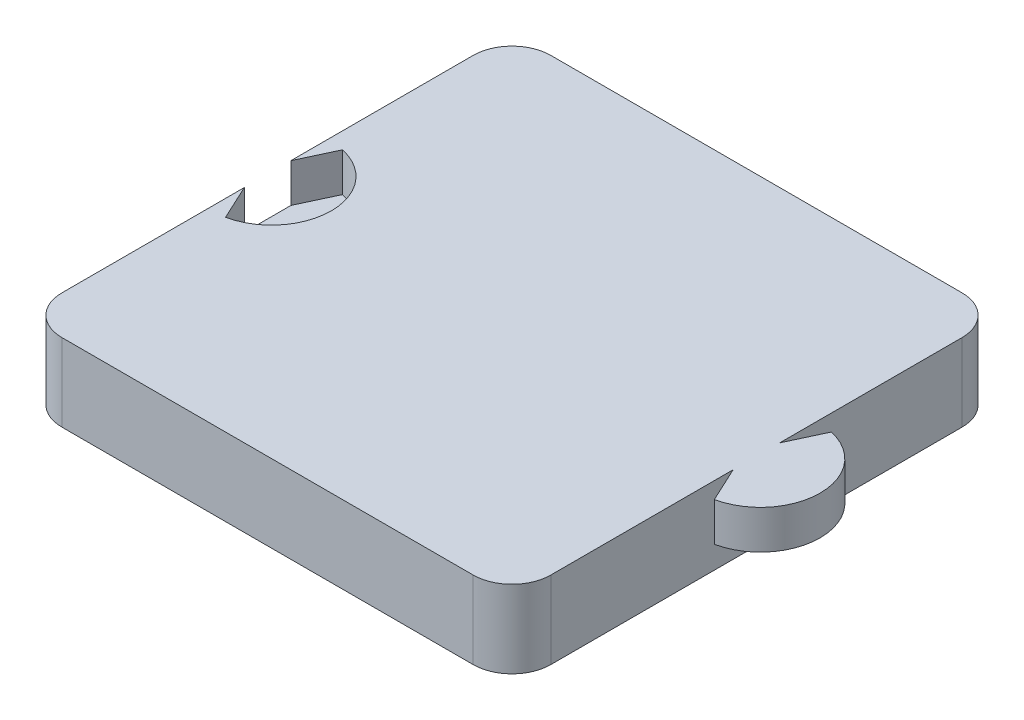
from build123d import *

# Parameters (mm, degrees)
BOSS_EXTRUDE1_DEPTH = 12.7
CUT_EXTRUDE1_DEPTH  = 6.35
BOSS_EXTRUDE2_DEPTH = 6.35


with BuildPart() as part:
    # Sketch1 → Boss-Extrude1 (new body)
    with BuildSketch(Plane(origin=(0, 0, 0), x_dir=(1, 0, 0), z_dir=(0, 1, 0))):
        with BuildLine():
            Line((-33.655, -40.005), (33.655, -40.005))
            ThreePointArc((33.655, -40.005), (38.145128061, -38.145128061), (40.005, -33.655))
            Line((40.005, -33.655), (40.005, 33.655))
            ThreePointArc((40.005, 33.655), (38.145128061, 38.145128061), (33.655, 40.005))
            Line((33.655, 40.005), (-33.655, 40.005))
            ThreePointArc((-33.655, 40.005), (-38.145128061, 38.145128061), (-40.005, 33.655))
            Line((-40.005, 33.655), (-40.005, -33.655))
            ThreePointArc((-40.005, -33.655), (-38.145128061, -38.145128061), (-33.655, -40.005))
        make_face()
    extrude(amount=BOSS_EXTRUDE1_DEPTH)

    # Sketch2 → Cut-Extrude1 (cut)
    with BuildSketch(Plane(origin=(0, 12.7, 0), x_dir=(1, 0, 0), z_dir=(0, 1, 0))):
        with BuildLine():
            Line((-40.005, 3.81), (-37.321374038, 9.565054448))
            ThreePointArc((-37.321374038, 9.565054448), (-29.576722684, 0), (-37.321374038, -9.565054448))
            Line((-37.321374038, -9.565054448), (-40.005, -3.81))
            Line((-40.005, -3.81), (-40.005, 3.81))
        make_face()
    extrude(amount=-CUT_EXTRUDE1_DEPTH, mode=Mode.SUBTRACT)

    # Sketch4 → Boss-Extrude2 (add)
    with BuildSketch(Plane(origin=(0, 12.7, 0), x_dir=(1, 0, 0), z_dir=(0, 1, 0))):
        with BuildLine():
            Line((42.688625962, 9.565054448), (40.005, 3.81))
            Line((40.005, 3.81), (40.005, -3.81))
            Line((40.005, -3.81), (42.688625962, -9.565054448))
            ThreePointArc((42.688625962, -9.565054448), (50.433277316, 0), (42.688625962, 9.565054448))
        make_face()
    extrude(amount=-BOSS_EXTRUDE2_DEPTH)


solid = part.part
